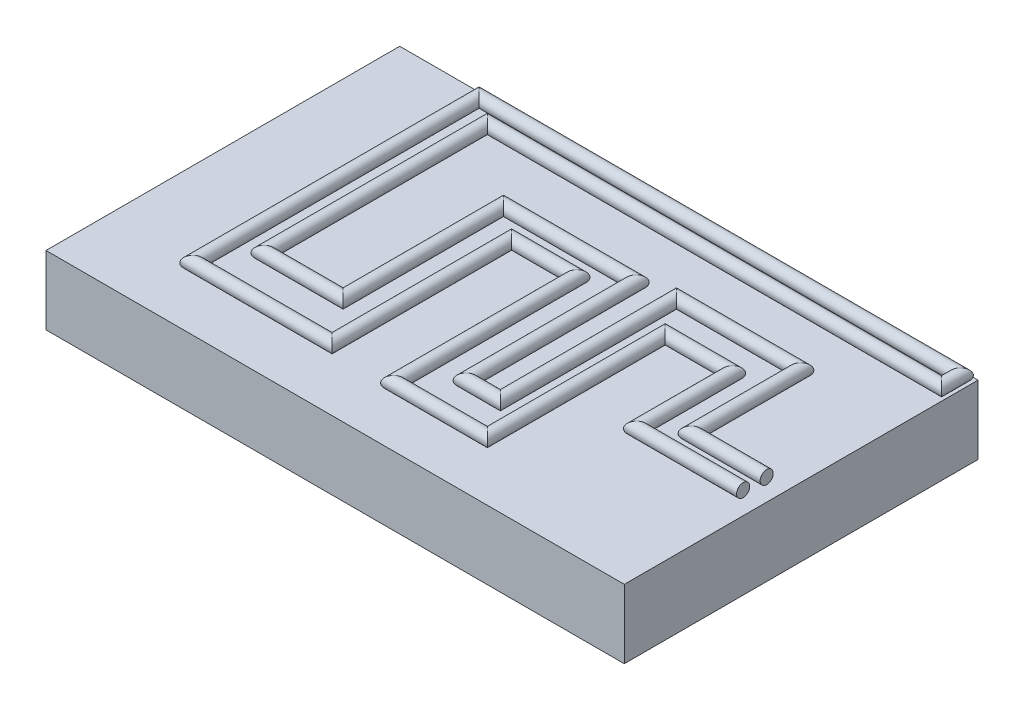
from build123d import *

# Parameters (mm, degrees)
SKETCH1_W           = 61.8
SKETCH1_H           = 37.8
BOSS_EXTRUDE1_DEPTH = 7.35
SWEEP10_PROFILE_R   = 0.7


with BuildPart() as part:
    # Sketch1 → Boss-Extrude1 (new body)
    with BuildSketch(Plane(origin=(0, 0, 0), x_dir=(1, 0, 0), z_dir=(0, 1, 0))):
        with Locations((30.9, 18.9)):
            Rectangle(SKETCH1_W, SKETCH1_H)
    extrude(amount=BOSS_EXTRUDE1_DEPTH)


with BuildPart() as body_2:
    # Sweep10: sweep along a curve in space
    with BuildLine() as sweep10_path:
        Line((50.348210612, 9.649049906, -12.767787099), (61.733496817, 9.649049906, -12.767787099))
        Line((50.348210612, 9.649049906, -23.024330237), (50.348210612, 9.649049906, -12.767787099))
        Line((43.150066459, 9.649049906, -23.024330237), (50.348210612, 9.649049906, -23.024330237))
        Line((43.150066459, 9.649049906, -4.01673083), (43.150066459, 9.649049906, -23.024330237))
        Line((33.140147245, 9.649049906, -4.01673083), (43.150066459, 9.649049906, -4.01673083))
        Line((33.140147245, 9.649049906, -23.586685249), (33.140147245, 9.649049906, -4.01673083))
        Line((26.166945096, 9.649049906, -23.586685249), (33.140147245, 9.649049906, -23.586685249))
        Line((26.166945096, 9.649049906, -4.405947917), (26.166945096, 9.649049906, -23.586685249))
        Line((11.292743837, 9.649049906, -4.405947917), (26.166945096, 9.649049906, -4.405947917))
        Line((11.292743837, 9.649049906, -4.405947917), (11.292743837, 9.649049906, -34.991932611))
        Line((11.292743837, 9.649049906, -34.991932611), (62.71996786, 9.649049906, -34.991932611))
        Line((62.71996786, 9.649049906, -32.991932611), (62.71996786, 9.649049906, -34.991932611))
        Line((14.172794182, 9.649049906, -32.991932611), (62.71996786, 9.649049906, -32.991932611))
        Line((14.172794182, 9.649049906, -32.991932611), (14.172794182, 9.649049906, -9.133529412))
        Line((14.172794182, 9.649049906, -9.133529412), (22.616013628, 9.649049906, -9.133529412))
        Line((22.616013628, 9.649049906, -9.133529412), (22.616013628, 9.649049906, -26.273866291))
        Line((22.616013628, 9.649049906, -26.273866291), (36.783339685, 9.649049906, -26.273866291))
        Line((36.783339685, 9.649049906, -26.273866291), (36.783339685, 9.649049906, -8.121979781))
        Line((36.783339685, 9.649049906, -8.121979781), (40.435853434, 9.649049906, -8.121979781))
        Line((40.435853434, 9.649049906, -8.121979781), (40.435853434, 9.649049906, -26.9379597))
        Line((40.435853434, 9.649049906, -26.9379597), (53.717721612, 9.649049906, -26.9379597))
        Line((53.717721612, 9.649049906, -26.9379597), (53.717721612, 9.649049906, -15.235955734))
        Line((53.717721612, 9.649049906, -15.235955734), (61.781400604, 9.649049906, -15.235955734))
    # Sweep10 profile (on start of the path) → Sweep10 (sweep)
    with BuildSketch(Plane(origin=(61.781400604, 9.649049906, -15.235955734), x_dir=(0, -1, 0), z_dir=(-1, 0, 0))):
        Circle(SWEEP10_PROFILE_R)
    sweep(path=sweep10_path.line, transition=Transition.RIGHT)


solid = Compound([part.part, body_2.part])
